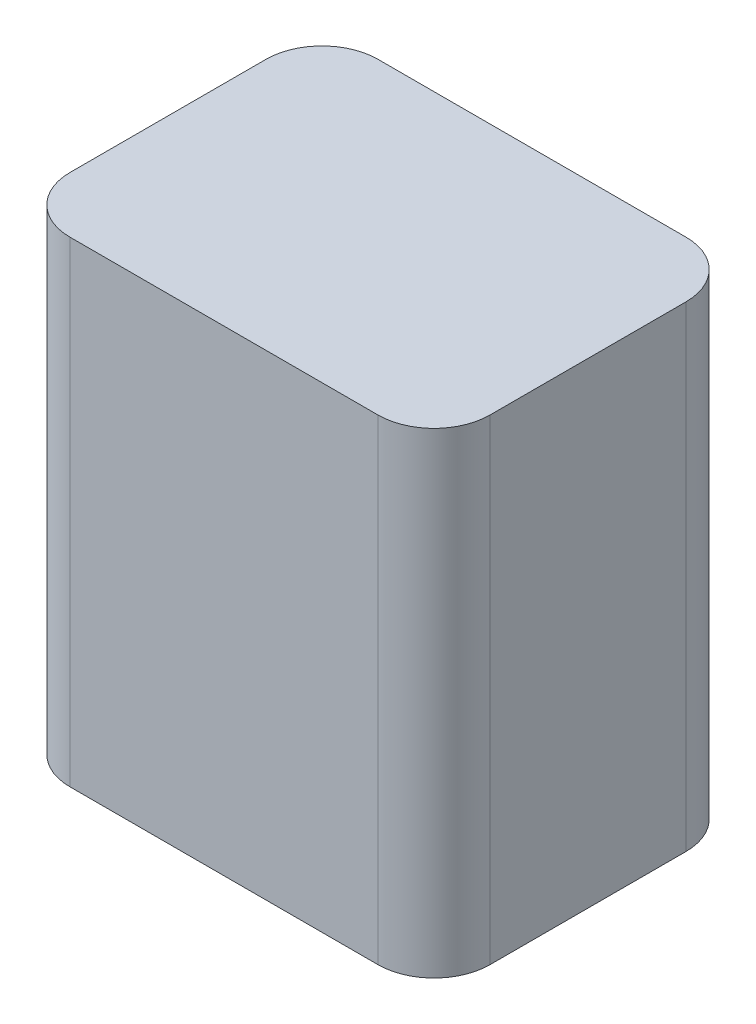
from build123d import *

# Parameters (mm, degrees)
CROQUIS1_W              = 15
CROQUIS1_H              = 17
SALIENTE_EXTRUIR1_DEPTH = 11
REDONDEO1_R             = 2


with BuildPart() as part:
    # Croquis1 → Saliente-Extruir1 (new body)
    with BuildSketch(Plane.XY):
        with Locations((-13.019978389, 0.031598513)):
            Rectangle(CROQUIS1_W, CROQUIS1_H)
    extrude(amount=SALIENTE_EXTRUIR1_DEPTH)

    # Redondeo1
    redondeo1_edges = [part.edges().sort_by_distance(p)[0] for p in [
        (-5.519978389, 0.031598513, 11),
        (-20.519978389, 0.031598513, 11),
        (-5.519978389, 0.031598513, 0),
        (-20.519978389, 0.031598513, 0),
    ]]
    fillet(redondeo1_edges, radius=REDONDEO1_R)


solid = part.part
